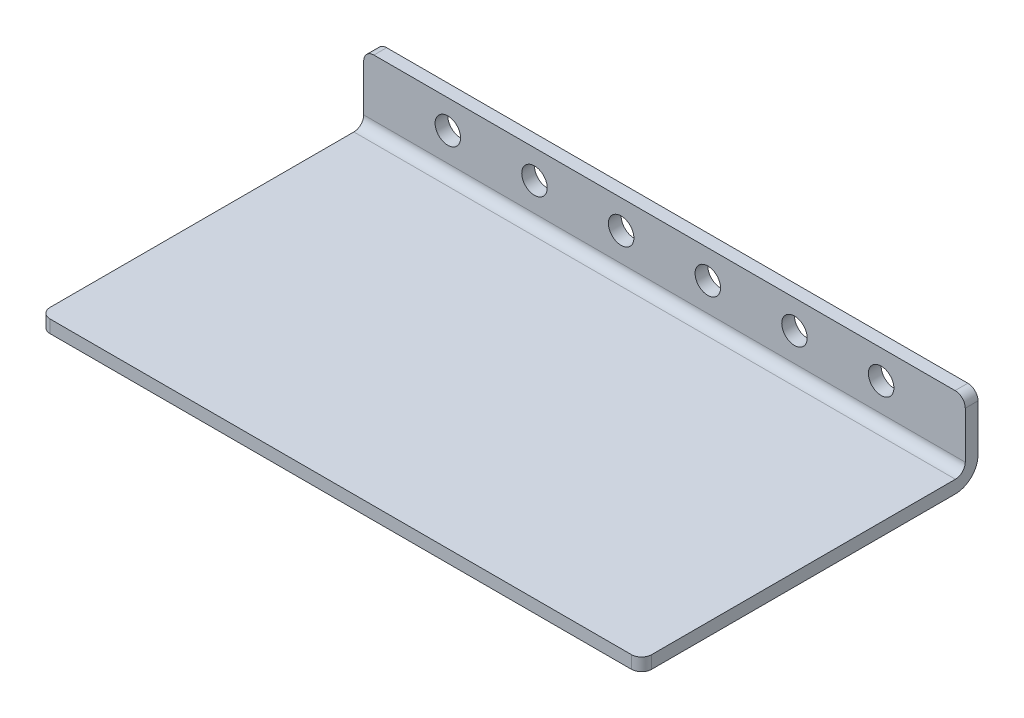
from build123d import *

# Parameters (mm, degrees)
BOSS_EXTRUDE1_DEPTH      = 37.465
BOSS_EXTRUDE1_DEPTH_BACK = 37.465
FILLET1_R                = 1.27
SKETCH2_R                = 1.5875
CUT_EXTRUDE1_DEPTH       = 58.080672394


with BuildPart() as part:
    # Sketch1 → Boss-Extrude1 (new, two sides: drawn at the far end of the back side and taken through both)
    with BuildSketch(Plane(origin=(0, 0, 0), x_dir=(0, 0, -1), z_dir=(1, 0, 0)).offset(-BOSS_EXTRUDE1_DEPTH_BACK)):
        with BuildLine():
            Line((-25.175589489, 0), (13.918974615, 0))
            ThreePointArc((13.918974615, 0), (15.909788429, 0.824622082), (16.734410511, 2.815435896))
            Line((16.734410511, 2.815435896), (16.734410511, 9.906))
            Line((16.734410511, 9.906), (15.146910511, 9.906))
            Line((15.146910511, 9.906), (15.146910511, 2.815435896))
            ThreePointArc((15.146910511, 2.815435896), (14.787256414, 1.947154097), (13.918974615, 1.5875))
            Line((13.918974615, 1.5875), (-25.175589489, 1.5875))
            Line((-25.175589489, 1.5875), (-25.175589489, 0))
        make_face()
    extrude(amount=BOSS_EXTRUDE1_DEPTH + BOSS_EXTRUDE1_DEPTH_BACK)

    # Fillet1
    fillet1_edges = [part.edges().sort_by_distance(p)[0] for p in [
        (-37.465, 9.906, -15.940660511),
        (37.465, 0.79375, 25.175589489),
        (37.465, 9.906, -15.940660511),
        (-37.465, 0.79375, 25.175589489),
    ]]
    fillet(fillet1_edges, radius=FILLET1_R)

    # Sketch2 → Cut-Extrude1 (cut, through all)
    with BuildSketch(Plane(origin=(0, 0, -16.734410511), x_dir=(-1, 0, 0), z_dir=(0, 0, -1))):
        with Locations((-26.9875, 6.360717948)):
            Circle(SKETCH2_R)
        with Locations((-16.1925, 6.360717948)):
            Circle(SKETCH2_R)
        with Locations((-5.3975, 6.360717948)):
            Circle(SKETCH2_R)
        with Locations((5.3975, 6.360717948)):
            Circle(SKETCH2_R)
        with Locations((16.1925, 6.360717948)):
            Circle(SKETCH2_R)
        with Locations((26.9875, 6.360717948)):
            Circle(SKETCH2_R)
    extrude(amount=-CUT_EXTRUDE1_DEPTH, mode=Mode.SUBTRACT)


solid = part.part
